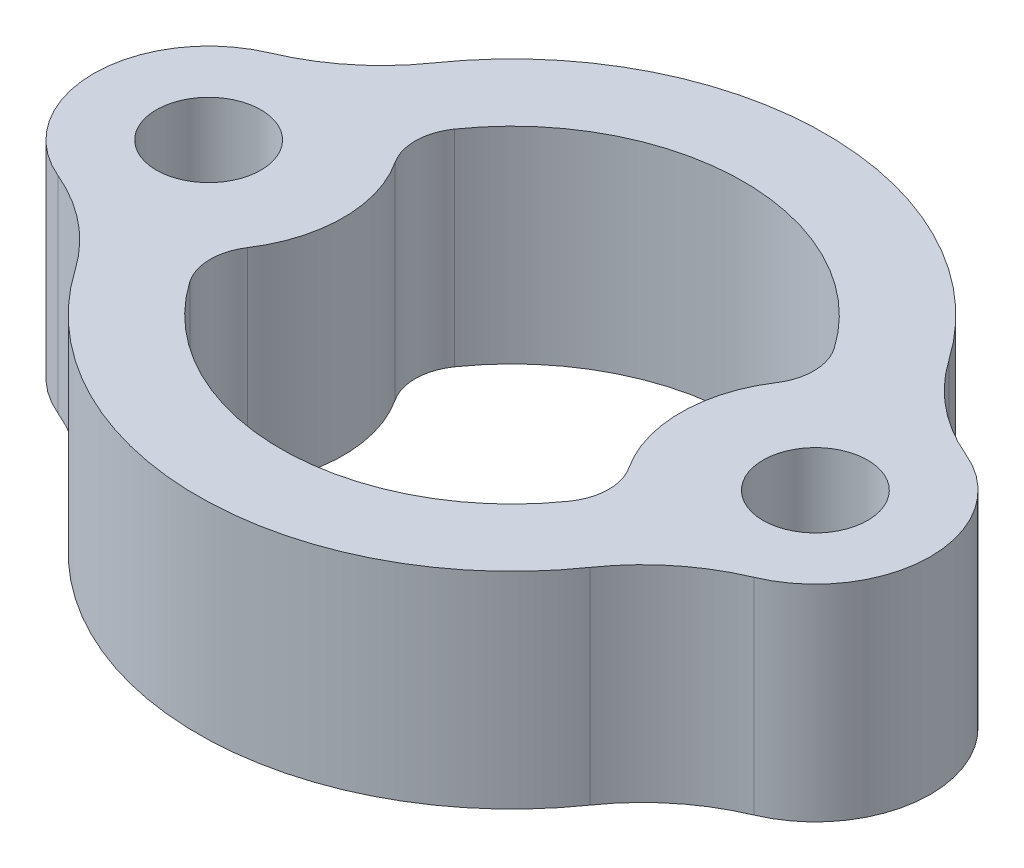
from build123d import *

# Parameters (mm, degrees)
SKETCH1_R           = 1.27
BOSS_EXTRUDE1_DEPTH = 2.5
FILLET1_R           = 5.08
CUT_EXTRUDE1_DEPTH  = 14.648809639
FILLET2_R           = 1.27


with BuildPart() as part:
    # Sketch1 → Boss-Extrude1 (new, symmetric)
    with BuildSketch(Plane(origin=(0, 0, 0), x_dir=(1, 0, 0), z_dir=(0, 1, 0))):
        with BuildLine():
            ThreePointArc((7.094482759, 2.780775861), (0, 7.62), (-7.094482759, 2.780775861))
            ThreePointArc((-7.094482759, 2.780775861), (-10.16, 0), (-7.094482759, -2.780775861))
            ThreePointArc((-7.094482759, -2.780775861), (0, -7.62), (7.094482759, -2.780775861))
            ThreePointArc((7.094482759, -2.780775861), (10.16, 0), (7.094482759, 2.780775861))
        make_face()
        with Locations((7.366, 0)):
            Circle(SKETCH1_R, mode=Mode.SUBTRACT)
        with Locations((-7.366, 0)):
            Circle(SKETCH1_R, mode=Mode.SUBTRACT)
    extrude(amount=BOSS_EXTRUDE1_DEPTH, both=True)

    # Fillet1
    fillet1_edges = [part.edges().sort_by_distance(p)[0] for p in [
        (7.094482759, 0, -2.780775861),
        (-7.094482759, 0, -2.780775861),
        (-7.094482759, 0, 2.780775861),
        (7.094482759, 0, 2.780775861),
    ]]
    fillet(fillet1_edges, radius=FILLET1_R)

    # Sketch2 → Cut-Extrude1 (cut, through all)
    with BuildSketch(Plane(origin=(0, 2.5, 0), x_dir=(1, 0, 0), z_dir=(0, 1, 0))):
        with BuildLine():
            ThreePointArc((5.213513626, 2.46164628), (4.096, 0), (5.213513626, -2.46164628))
            ThreePointArc((5.213513626, -2.46164628), (4.900166041, -2.826173582), (4.612275862, -3.21112307))
            ThreePointArc((4.612275862, -3.21112307), (0, -5.62), (-4.612275862, -3.21112307))
            ThreePointArc((-4.612275862, -3.21112307), (-4.900166041, -2.826173582), (-5.213513626, -2.46164628))
            ThreePointArc((-5.213513626, -2.46164628), (-4.096, 0), (-5.213513626, 2.46164628))
            ThreePointArc((-5.213513626, 2.46164628), (-4.900166041, 2.826173582), (-4.612275862, 3.21112307))
            ThreePointArc((-4.612275862, 3.21112307), (0, 5.62), (4.612275862, 3.21112307))
            ThreePointArc((4.612275862, 3.21112307), (4.900166041, 2.826173582), (5.213513626, 2.46164628))
        make_face()
    extrude(amount=-CUT_EXTRUDE1_DEPTH, mode=Mode.SUBTRACT)

    # Fillet2
    fillet2_edges = [part.edges().sort_by_distance(p)[0] for p in [
        (5.213513626, 0, -2.46164628),
        (-5.213513626, 0, -2.46164628),
        (-5.213513626, 0, 2.46164628),
        (5.213513626, 0, 2.46164628),
    ]]
    fillet(fillet2_edges, radius=FILLET2_R)


solid = part.part
